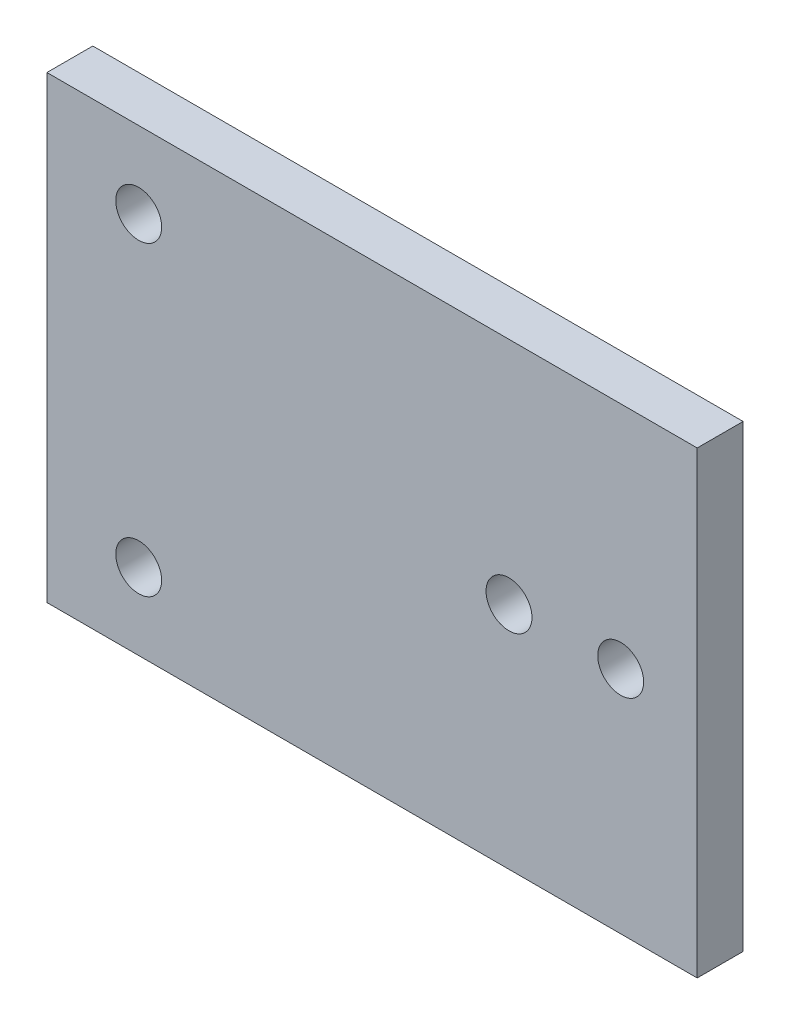
from build123d import *

# Parameters (mm, degrees)
CROQUIS1_W              = 42.5
CROQUIS1_H              = 30
CROQUIS1_R              = 1.5
SALIENTE_EXTRUIR1_DEPTH = 3


with BuildPart() as part:
    # Croquis1 → Saliente-Extruir1 (new body)
    with BuildSketch(Plane.XY):
        with Locations((21.25, 15)):
            Rectangle(CROQUIS1_W, CROQUIS1_H)
        with Locations((6, 25)):
            Circle(CROQUIS1_R, mode=Mode.SUBTRACT)
        with Locations(Location((6, 5, 0), (0, 0, 180))):
            Circle(CROQUIS1_R, mode=Mode.SUBTRACT)
        with Locations((37.5, 15)):
            Circle(CROQUIS1_R, mode=Mode.SUBTRACT)
        with Locations((30.2, 15)):
            Circle(CROQUIS1_R, mode=Mode.SUBTRACT)
    extrude(amount=SALIENTE_EXTRUIR1_DEPTH)


solid = part.part
